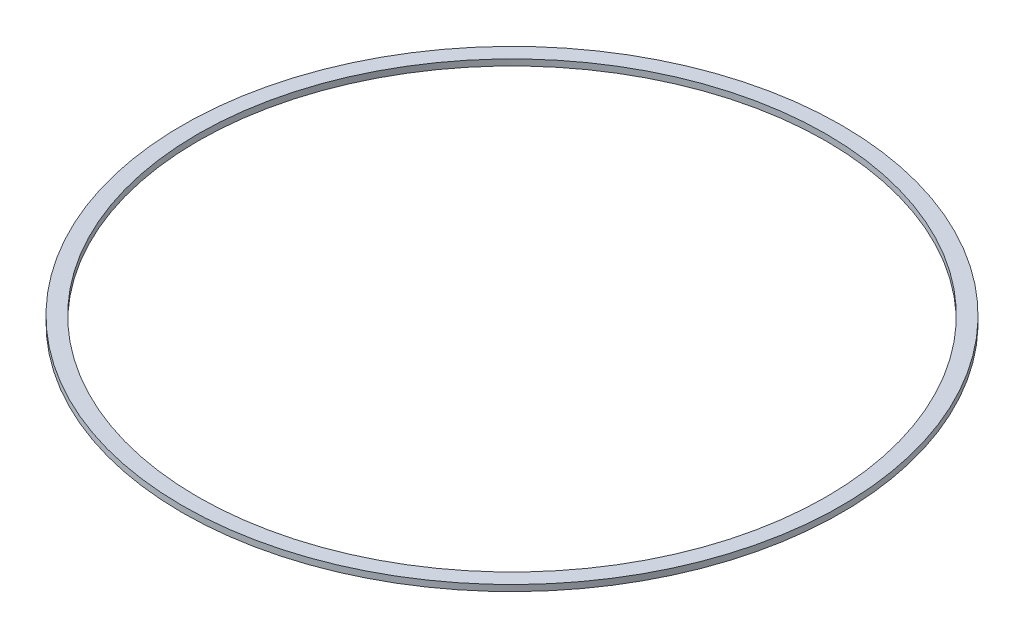
from build123d import *

# Parameters (mm, degrees)
SKETCH1_R           = 136.525
SKETCH1_R_2         = 130.175
BOSS_EXTRUDE1_DEPTH = 2.54


with BuildPart() as part:
    # Sketch1 → Boss-Extrude1 (new body)
    with BuildSketch(Plane(origin=(0, 0, 0), x_dir=(1, 0, 0), z_dir=(0, 1, 0))):
        with Locations(Location((0, 0, 0), (0, 0, 270))):
            Circle(SKETCH1_R)
        with Locations(Location((0, 0, 0), (0, 0, 270))):
            Circle(SKETCH1_R_2, mode=Mode.SUBTRACT)
    extrude(amount=BOSS_EXTRUDE1_DEPTH)


solid = part.part
